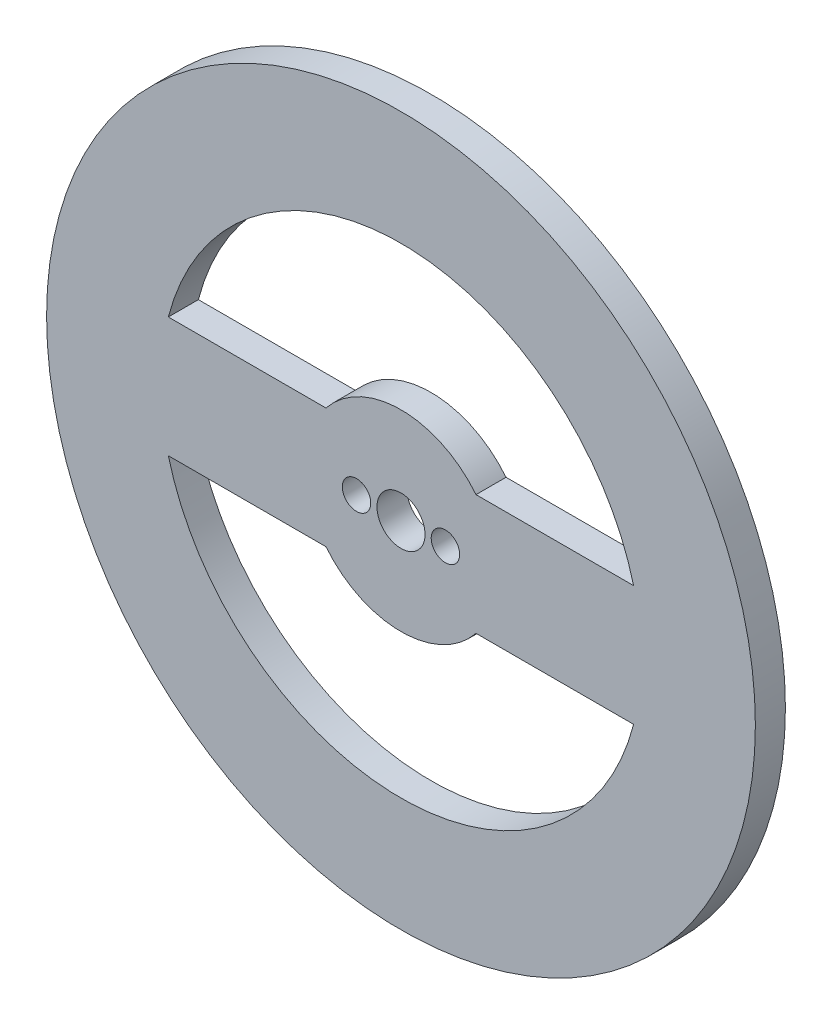
from build123d import *

# Parameters (mm, degrees)
SKETCH1_R           = 37.465
BOSS_EXTRUDE1_DEPTH = 3.175
CUT_EXTRUDE1_DEPTH  = 54.078555698
SKETCH3_R           = 2.54
CUT_EXTRUDE2_DEPTH  = 54.078555698
SKETCH4_R           = 1.505
CUT_EXTRUDE3_DEPTH  = 54.078555698


with BuildPart() as part:
    # Sketch1 → Boss-Extrude1 (new body)
    with BuildSketch(Plane.XY):
        Circle(SKETCH1_R)
    extrude(amount=BOSS_EXTRUDE1_DEPTH)

    # Sketch2 → Cut-Extrude1 (cut, through all)
    with BuildSketch(Plane.XY.offset(3.175)):
        with BuildLine():
            Line((-24.593444248, -6.35), (-7.931147458, -6.35))
            ThreePointArc((-7.931147458, -6.35), (0, -10.16), (7.931147458, -6.35))
            Line((7.931147458, -6.35), (24.593444248, -6.35))
            ThreePointArc((24.593444248, -6.35), (0, -25.4), (-24.593444248, -6.35))
        make_face()
        with BuildLine():
            Line((7.931147458, 6.35), (24.593444248, 6.35))
            ThreePointArc((24.593444248, 6.35), (0, 25.4), (-24.593444248, 6.35))
            Line((-24.593444248, 6.35), (-7.931147458, 6.35))
            ThreePointArc((-7.931147458, 6.35), (0, 10.16), (7.931147458, 6.35))
        make_face()
    extrude(amount=-CUT_EXTRUDE1_DEPTH, mode=Mode.SUBTRACT)

    # Sketch3 → Cut-Extrude2 (cut, through all)
    with BuildSketch(Plane.XY.offset(3.175)):
        Circle(SKETCH3_R)
    extrude(amount=-CUT_EXTRUDE2_DEPTH, mode=Mode.SUBTRACT)

    # Sketch4 → Cut-Extrude3 (cut, through all)
    with BuildSketch(Plane(origin=(0, 0, 0), x_dir=(-1, 0, 0), z_dir=(0, 0, -1))):
        with Locations((-4.699, 0)):
            Circle(SKETCH4_R)
        with Locations((4.699, 0)):
            Circle(SKETCH4_R)
    extrude(amount=-CUT_EXTRUDE3_DEPTH, mode=Mode.SUBTRACT)


solid = part.part
